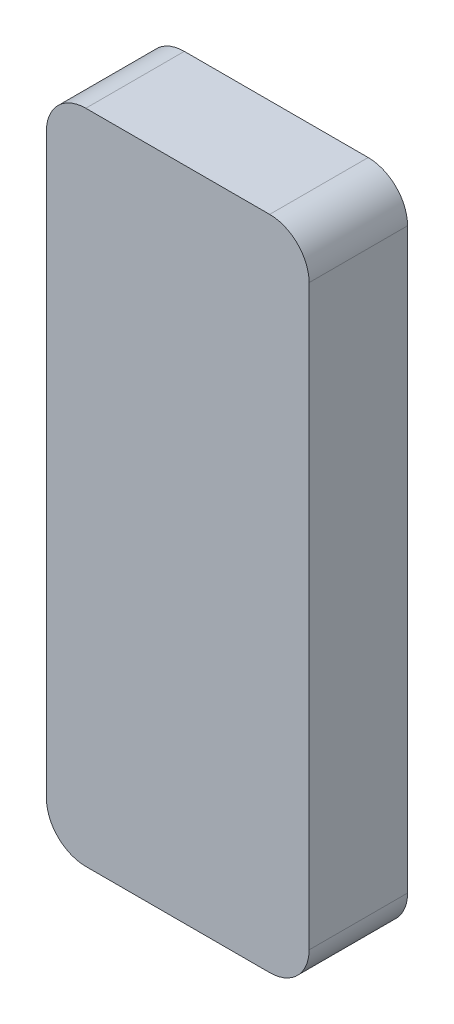
from build123d import *

# Parameters (mm, degrees)
BOSS_EXTRUDE1_DEPTH = 15


with BuildPart() as part:
    # Sketch1 → Boss-Extrude1 (new body)
    with BuildSketch(Plane.XY):
        with BuildLine():
            Line((6, 0), (34, 0))
            ThreePointArc((34, 0), (38.242640687, 1.757359313), (40, 6))
            Line((40, 6), (40, 94))
            ThreePointArc((40, 94), (38.242640687, 98.242640687), (34, 100))
            Line((34, 100), (6, 100))
            ThreePointArc((6, 100), (1.757359313, 98.242640687), (0, 94))
            Line((0, 94), (0, 6))
            ThreePointArc((0, 6), (1.757359313, 1.757359313), (6, 0))
        make_face()
    extrude(amount=BOSS_EXTRUDE1_DEPTH)


solid = part.part
